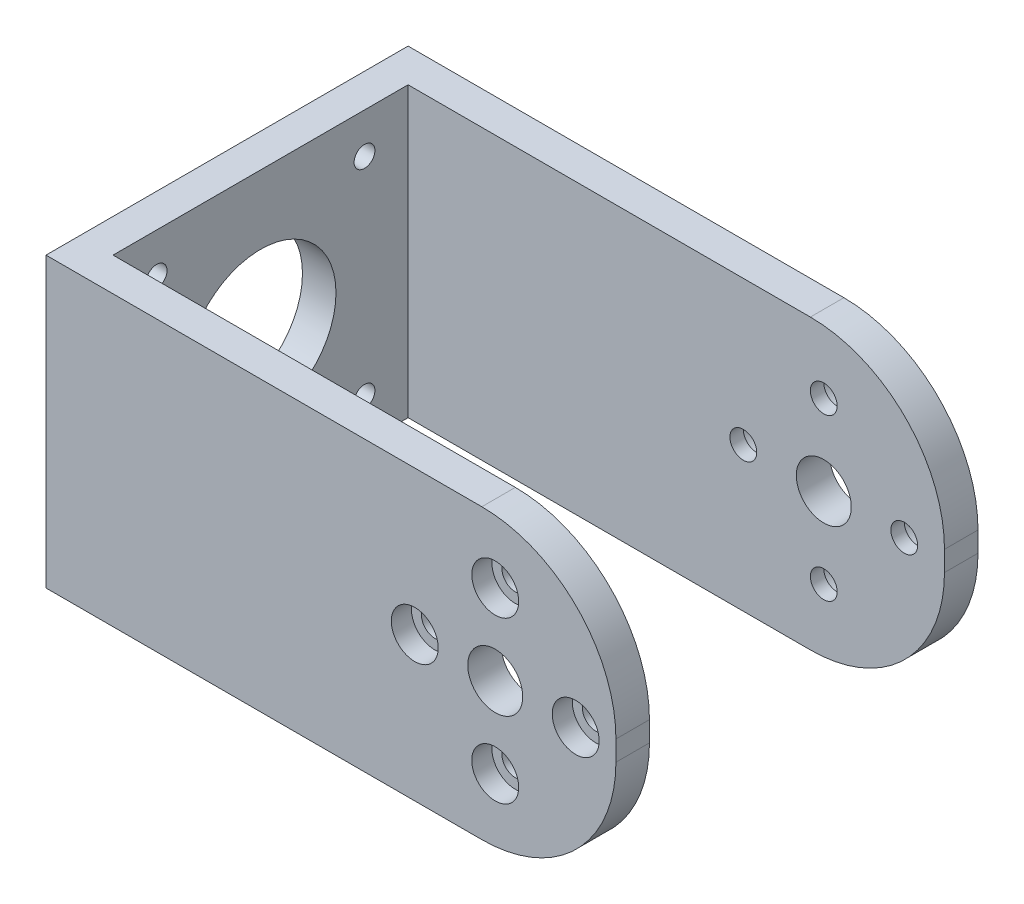
from build123d import *

# Parameters (mm, degrees)
SKETCH1_W           = 54
SKETCH1_H           = 43
BOSS_EXTRUDE1_DEPTH = 5
CUT_EXTRUDE1_REACH  = 36.875
SKETCH2_R           = 1.55
SKETCH2_R_2         = 11.25
SKETCH4_W           = 5
SKETCH4_H           = 43
BOSS_EXTRUDE2_DEPTH = 80
CUT_EXTRUDE2_REACH  = 104.972
SKETCH6_R           = 2
SKETCH6_R_2         = 4.1
SKETCH7_R           = 3.5
CUT_EXTRUDE3_DEPTH  = 3
FILLET1_R           = 20


with BuildPart() as part:
    # Sketch1 → Boss-Extrude1 (new body)
    with BuildSketch(Plane(origin=(0, 0, 0), x_dir=(0, 0, -1), z_dir=(1, 0, 0))):
        Rectangle(SKETCH1_W, SKETCH1_H)
    extrude(amount=BOSS_EXTRUDE1_DEPTH)

    # Sketch2 → Cut-Extrude1 (cut, up to next)
    with BuildSketch(Plane(origin=(5, 0, 0), x_dir=(0, 0, -1), z_dir=(1, 0, 0)), mode=Mode.PRIVATE) as cut_extrude1_sk1:
        with Locations((-15.5, 15.5)):
            Circle(SKETCH2_R)
    cut_extrude1_tool1 = extrude(cut_extrude1_sk1.sketch, amount=-CUT_EXTRUDE1_REACH, mode=Mode.PRIVATE) & part.part
    # Sketch2 → Cut-Extrude1 (cut, up to next)
    with BuildSketch(Plane(origin=(5, 0, 0), x_dir=(0, 0, -1), z_dir=(1, 0, 0)), mode=Mode.PRIVATE) as cut_extrude1_sk2:
        with Locations((15.5, 15.5)):
            Circle(SKETCH2_R)
    cut_extrude1_tool2 = extrude(cut_extrude1_sk2.sketch, amount=-CUT_EXTRUDE1_REACH, mode=Mode.PRIVATE) & part.part
    # Sketch2 → Cut-Extrude1 (cut, up to next)
    with BuildSketch(Plane(origin=(5, 0, 0), x_dir=(0, 0, -1), z_dir=(1, 0, 0)), mode=Mode.PRIVATE) as cut_extrude1_sk3:
        with Locations((15.5, -15.5)):
            Circle(SKETCH2_R)
    cut_extrude1_tool3 = extrude(cut_extrude1_sk3.sketch, amount=-CUT_EXTRUDE1_REACH, mode=Mode.PRIVATE) & part.part
    # Sketch2 → Cut-Extrude1 (cut, up to next)
    with BuildSketch(Plane(origin=(5, 0, 0), x_dir=(0, 0, -1), z_dir=(1, 0, 0)), mode=Mode.PRIVATE) as cut_extrude1_sk4:
        with Locations((-15.5, -15.5)):
            Circle(SKETCH2_R)
    cut_extrude1_tool4 = extrude(cut_extrude1_sk4.sketch, amount=-CUT_EXTRUDE1_REACH, mode=Mode.PRIVATE) & part.part
    # Sketch2 → Cut-Extrude1 (cut, up to next)
    with BuildSketch(Plane(origin=(5, 0, 0), x_dir=(0, 0, -1), z_dir=(1, 0, 0)), mode=Mode.PRIVATE) as cut_extrude1_sk5:
        Circle(SKETCH2_R_2)
    cut_extrude1_tool5 = extrude(cut_extrude1_sk5.sketch, amount=-CUT_EXTRUDE1_REACH, mode=Mode.PRIVATE) & part.part
    add(cut_extrude1_tool1.solids().sort_by_distance((5, 15.5, 15.5))[0], mode=Mode.SUBTRACT)
    add(cut_extrude1_tool2.solids().sort_by_distance((5, 15.5, -15.5))[0], mode=Mode.SUBTRACT)
    add(cut_extrude1_tool3.solids().sort_by_distance((5, -15.5, -15.5))[0], mode=Mode.SUBTRACT)
    add(cut_extrude1_tool4.solids().sort_by_distance((5, -15.5, 15.5))[0], mode=Mode.SUBTRACT)
    add(cut_extrude1_tool5.solids().sort_by_distance((5, 0, 0))[0], mode=Mode.SUBTRACT)

    # Sketch4 → Boss-Extrude2 (add)
    with BuildSketch(Plane(origin=(5, 0, 0), x_dir=(0, 0, -1), z_dir=(1, 0, 0))):
        with Locations((-24.5, 0)):
            Rectangle(SKETCH4_W, SKETCH4_H)
    boss_extrude2 = extrude(amount=BOSS_EXTRUDE2_DEPTH)

    # Sketch6 → Cut-Extrude2 (cut, up to next)
    with BuildSketch(Plane.XY.offset(27), mode=Mode.PRIVATE) as cut_extrude2_sk1:
        with Locations((67, 12)):
            Circle(SKETCH6_R)
    cut_extrude2_tool1 = extrude(cut_extrude2_sk1.sketch, amount=-CUT_EXTRUDE2_REACH, mode=Mode.PRIVATE) & part.part
    # Sketch6 → Cut-Extrude2 (cut, up to next)
    with BuildSketch(Plane.XY.offset(27), mode=Mode.PRIVATE) as cut_extrude2_sk2:
        with Locations((79, 0)):
            Circle(SKETCH6_R)
    cut_extrude2_tool2 = extrude(cut_extrude2_sk2.sketch, amount=-CUT_EXTRUDE2_REACH, mode=Mode.PRIVATE) & part.part
    # Sketch6 → Cut-Extrude2 (cut, up to next)
    with BuildSketch(Plane.XY.offset(27), mode=Mode.PRIVATE) as cut_extrude2_sk3:
        with Locations((67, -12)):
            Circle(SKETCH6_R)
    cut_extrude2_tool3 = extrude(cut_extrude2_sk3.sketch, amount=-CUT_EXTRUDE2_REACH, mode=Mode.PRIVATE) & part.part
    # Sketch6 → Cut-Extrude2 (cut, up to next)
    with BuildSketch(Plane.XY.offset(27), mode=Mode.PRIVATE) as cut_extrude2_sk4:
        with Locations((55, 0)):
            Circle(SKETCH6_R)
    cut_extrude2_tool4 = extrude(cut_extrude2_sk4.sketch, amount=-CUT_EXTRUDE2_REACH, mode=Mode.PRIVATE) & part.part
    # Sketch6 → Cut-Extrude2 (cut, up to next)
    with BuildSketch(Plane.XY.offset(27), mode=Mode.PRIVATE) as cut_extrude2_sk5:
        with Locations((67, 0)):
            Circle(SKETCH6_R_2)
    cut_extrude2_tool5 = extrude(cut_extrude2_sk5.sketch, amount=-CUT_EXTRUDE2_REACH, mode=Mode.PRIVATE) & part.part
    cut_extrude2_1 = cut_extrude2_tool1.solids().sort_by_distance((67, 12, 27))[0]
    add(cut_extrude2_1, mode=Mode.SUBTRACT)
    cut_extrude2_2 = cut_extrude2_tool2.solids().sort_by_distance((79, 0, 27))[0]
    add(cut_extrude2_2, mode=Mode.SUBTRACT)
    cut_extrude2_3 = cut_extrude2_tool3.solids().sort_by_distance((67, -12, 27))[0]
    add(cut_extrude2_3, mode=Mode.SUBTRACT)
    cut_extrude2_4 = cut_extrude2_tool4.solids().sort_by_distance((55, 0, 27))[0]
    add(cut_extrude2_4, mode=Mode.SUBTRACT)
    cut_extrude2_5 = cut_extrude2_tool5.solids().sort_by_distance((67, 0, 27))[0]
    add(cut_extrude2_5, mode=Mode.SUBTRACT)
    cut_extrude2 = cut_extrude2_1 + cut_extrude2_2 + cut_extrude2_3 + cut_extrude2_4 + cut_extrude2_5  # Cut-Extrude2 as one shape, for the pattern or mirror that repeats it

    # Sketch7 → Cut-Extrude3 (cut)
    with BuildSketch(Plane.XY.offset(27)):
        with Locations((67, 12)):
            Circle(SKETCH7_R)
        with Locations((79, 0)):
            Circle(SKETCH7_R)
        with Locations((67, -12)):
            Circle(SKETCH7_R)
        with Locations((55, 0)):
            Circle(SKETCH7_R)
    cut_extrude3 = extrude(amount=-CUT_EXTRUDE3_DEPTH, mode=Mode.SUBTRACT)

    # Mirror2: Boss-Extrude2, Cut-Extrude2, Cut-Extrude3 across plane
    add(boss_extrude2.mirror(Plane.XY))
    add(cut_extrude2.mirror(Plane.XY), mode=Mode.SUBTRACT)
    add(cut_extrude3.mirror(Plane.XY), mode=Mode.SUBTRACT)

    # Fillet1
    fillet1_edges = [part.edges().sort_by_distance(p)[0] for p in [
        (85, -21.5, 24.5),
        (85, 21.5, 24.5),
        (85, 21.5, -24.5),
        (85, -21.5, -24.5),
    ]]
    fillet(fillet1_edges, radius=FILLET1_R)


solid = part.part
